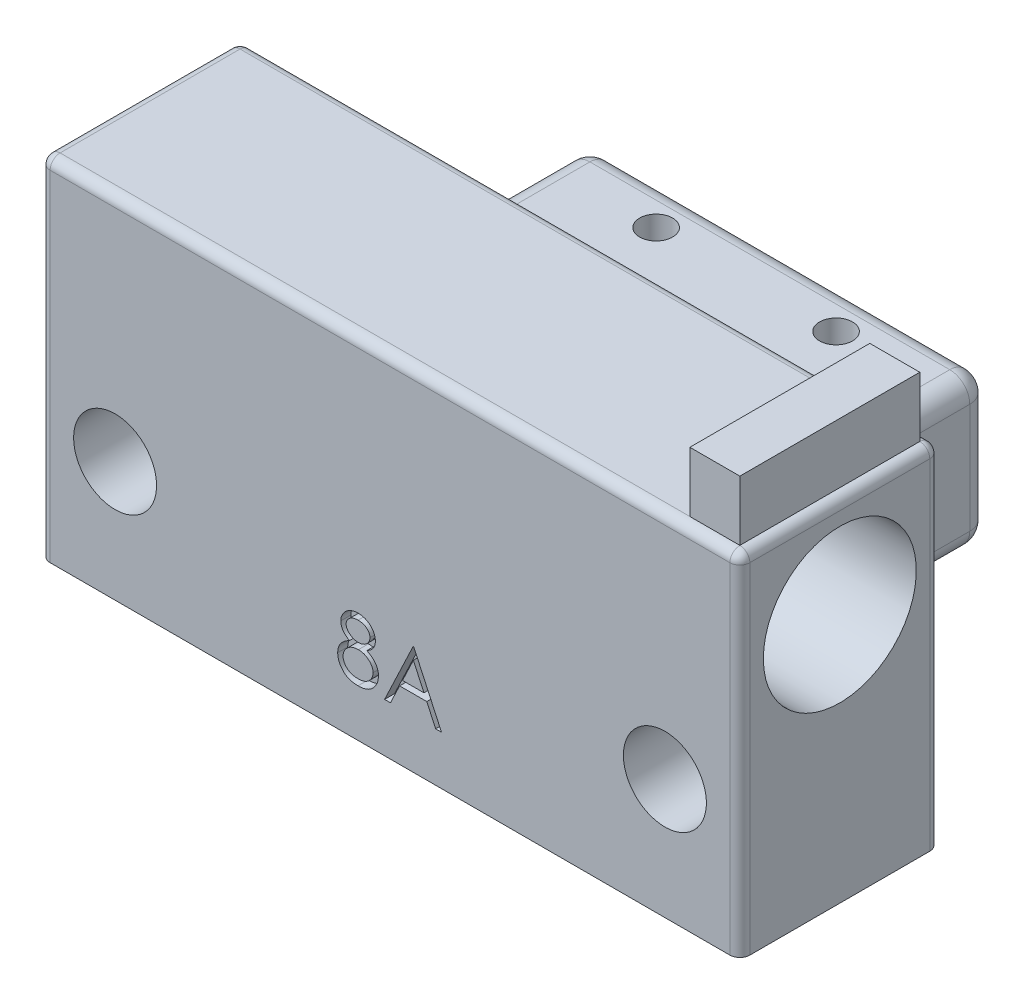
from build123d import *

# Parameters (mm, degrees)
CROQUIS1_W              = 70
CROQUIS1_H              = 20
SALIENTE_EXTRUIR1_DEPTH = 35
CROQUIS2_R              = 7.65
CORTAR_EXTRUIR1_DEPTH   = 79.89866919
CROQUIS3_R              = 4.15
CORTAR_EXTRUIR2_DEPTH   = 54.38539126
REDONDEO1_R             = 1
CROQUIS5_W              = 40
CROQUIS5_H              = 15
SALIENTE_EXTRUIR3_DEPTH = 20
REDONDEO3_R             = 2
CORTAR_EXTRUIR3_REACH   = 53.844
CROQUIS6_R              = 1.65
CORTAR_EXTRUIR4_DEPTH   = 1
CROQUIS8_W              = 5
CROQUIS8_H              = 18
SALIENTE_EXTRUIR4_DEPTH = 6


with BuildPart() as part:
    # Croquis1 → Saliente-Extruir1 (new body)
    with BuildSketch(Plane(origin=(0, 0, 0), x_dir=(1, 0, 0), z_dir=(0, 1, 0))):
        Rectangle(CROQUIS1_W, CROQUIS1_H)
    extrude(amount=SALIENTE_EXTRUIR1_DEPTH)

    # Croquis2 → Cortar-Extruir1 (cut, through all)
    with BuildSketch(Plane.ZY.offset(35)):
        with Locations((0, 25)):
            Circle(CROQUIS2_R)
    extrude(amount=-CORTAR_EXTRUIR1_DEPTH, mode=Mode.SUBTRACT)

    # Croquis3 → Cortar-Extruir2 (cut, through all)
    with BuildSketch(Plane(origin=(0, 0, -10), x_dir=(-1, 0, 0), z_dir=(0, 0, -1))):
        with Locations((-27.5, 12)):
            Circle(CROQUIS3_R)
        with Locations((27.5, 12)):
            Circle(CROQUIS3_R)
    extrude(amount=-CORTAR_EXTRUIR2_DEPTH, mode=Mode.SUBTRACT)

    # Redondeo1
    redondeo1_edges = [part.edges().sort_by_distance(p)[0] for p in [
        (-35, 35, 0),
        (0, 35, 10),
        (35, 35, 0),
        (0, 35, -10),
        (35, 17.5, 10),
        (-35, 17.5, 10),
        (-35, 17.5, -10),
        (35, 17.5, -10),
    ]]
    fillet(redondeo1_edges, radius=REDONDEO1_R)

    # Croquis5 → Saliente-Extruir3 (add)
    with BuildSketch(Plane(origin=(0, 0, -10), x_dir=(-1, 0, 0), z_dir=(0, 0, -1))):
        with Locations((0, 16.2232378)):
            Rectangle(CROQUIS5_W, CROQUIS5_H)
    extrude(amount=SALIENTE_EXTRUIR3_DEPTH)

    # Redondeo3
    redondeo3_edges = [part.edges().sort_by_distance(p)[0] for p in [
        (-20, 16.2232378, -10),
        (-20, 8.7232378, -20),
        (0, 23.7232378, -10),
        (-20, 23.7232378, -20),
        (20, 16.2232378, -10),
        (20, 23.7232378, -20),
        (0, 8.7232378, -10),
        (20, 8.7232378, -20),
        (-20, 16.2232378, -30),
        (0, 23.7232378, -30),
        (20, 16.2232378, -30),
        (0, 8.7232378, -30),
    ]]
    fillet(redondeo3_edges, radius=REDONDEO3_R)

    # Croquis6 → Cortar-Extruir3 (cut, up to next)
    with BuildSketch(Plane(origin=(0, 23.7232378, 0), x_dir=(1, 0, 0), z_dir=(0, 1, 0)), mode=Mode.PRIVATE) as cortar_extruir3_sk1:
        with Locations(Location((9, 14.375, 0), (0, 0, 270))):
            Circle(CROQUIS6_R)
    cortar_extruir3_tool1 = extrude(cortar_extruir3_sk1.sketch, amount=-CORTAR_EXTRUIR3_REACH, mode=Mode.PRIVATE) & part.part
    # Croquis6 → Cortar-Extruir3 (cut, up to next)
    with BuildSketch(Plane(origin=(0, 23.7232378, 0), x_dir=(1, 0, 0), z_dir=(0, 1, 0)), mode=Mode.PRIVATE) as cortar_extruir3_sk2:
        with Locations(Location((9, 25.625, 0), (0, 0, 270))):
            Circle(CROQUIS6_R)
    cortar_extruir3_tool2 = extrude(cortar_extruir3_sk2.sketch, amount=-CORTAR_EXTRUIR3_REACH, mode=Mode.PRIVATE) & part.part
    # Croquis6 → Cortar-Extruir3 (cut, up to next)
    with BuildSketch(Plane(origin=(0, 23.7232378, 0), x_dir=(1, 0, 0), z_dir=(0, 1, 0)), mode=Mode.PRIVATE) as cortar_extruir3_sk3:
        with Locations(Location((-9, 25.625, 0), (0, 0, 270))):
            Circle(CROQUIS6_R)
    cortar_extruir3_tool3 = extrude(cortar_extruir3_sk3.sketch, amount=-CORTAR_EXTRUIR3_REACH, mode=Mode.PRIVATE) & part.part
    # Croquis6 → Cortar-Extruir3 (cut, up to next)
    with BuildSketch(Plane(origin=(0, 23.7232378, 0), x_dir=(1, 0, 0), z_dir=(0, 1, 0)), mode=Mode.PRIVATE) as cortar_extruir3_sk4:
        with Locations(Location((-9, 14.375, 0), (0, 0, 270))):
            Circle(CROQUIS6_R)
    cortar_extruir3_tool4 = extrude(cortar_extruir3_sk4.sketch, amount=-CORTAR_EXTRUIR3_REACH, mode=Mode.PRIVATE) & part.part
    add(cortar_extruir3_tool1.solids().sort_by_distance((9, 23.723238, -14.375))[0], mode=Mode.SUBTRACT)
    add(cortar_extruir3_tool2.solids().sort_by_distance((9, 23.723238, -25.625))[0], mode=Mode.SUBTRACT)
    add(cortar_extruir3_tool3.solids().sort_by_distance((-9, 23.723238, -25.625))[0], mode=Mode.SUBTRACT)
    add(cortar_extruir3_tool4.solids().sort_by_distance((-9, 23.723238, -14.375))[0], mode=Mode.SUBTRACT)

    # Croquis7 → Cortar-Extruir4 (cut)
    # profile 1 of 2: a face of its own
    with BuildSketch(Plane.XY.offset(10)):
        with BuildLine():
            add(Edge.make_bspline(
                [(-2.313701923, 8.228996938), (-2.264590128, 8.203389014), (-2.168805726, 8.153445009), (-2.032387655, 8.073026447), (-1.907716224, 7.988270507), (-1.791332404, 7.903180462), (-1.685280945, 7.814497631), (-1.590747666, 7.721869364), (-1.50539746, 7.627607743), (-1.430951545, 7.530116589), (-1.365471253, 7.429654904), (-1.308879022, 7.325959008), (-1.260506674, 7.21925615), (-1.222170208, 7.108381584), (-1.190589993, 6.994963993), (-1.168860385, 6.877538881), (-1.15717424, 6.756880011), (-1.154964845, 6.675334351), (-1.153846154, 6.634045015)],
                knots=[0, 0, 0, 0, 1.272397273, 2.481599622, 3.635517121, 4.734568067, 5.792894095, 6.808321871, 7.773003508, 8.711915296, 9.623354172, 10.525449501, 11.423591555, 12.311487226, 13.218079475, 14.126165749, 15.051214107, 16, 16, 16, 16], degree=3))
            add(Edge.make_bspline(
                [(-1.153846154, 6.634045015), (-1.155168589, 6.576277473), (-1.157786185, 6.461933833), (-1.180586157, 6.293169071), (-1.214722692, 6.129263159), (-1.264573284, 5.970252032), (-1.329224811, 5.817013106), (-1.408899387, 5.669415209), (-1.499090025, 5.52503925), (-1.571522435, 5.43620599), (-1.608173077, 5.391256554)],
                knots=[0, 0, 0, 0, 1.025265484, 2.029385089, 3.018602448, 3.995076438, 4.983346944, 5.966715145, 6.97116228, 8, 8, 8, 8], degree=3))
            add(Edge.make_bspline(
                [(-1.608173077, 5.391256554), (-1.655892747, 5.338810084), (-1.750742402, 5.234565239), (-1.913227421, 5.099220993), (-2.091550651, 4.985479175), (-2.285022078, 4.892784498), (-2.493124538, 4.820637312), (-2.715813688, 4.768792995), (-2.953523665, 4.739097402), (-3.116904472, 4.734804849), (-3.200721154, 4.732602707)],
                knots=[0, 0, 0, 0, 0.954267603, 1.896743057, 2.838368354, 3.796610408, 4.779680527, 5.799409237, 6.871065594, 8, 8, 8, 8], degree=3))
            add(Edge.make_bspline(
                [(-3.200721154, 4.732602707), (-3.281315534, 4.734578384), (-3.438144013, 4.73842285), (-3.66641466, 4.764470447), (-3.879197065, 4.810118218), (-4.077728439, 4.872594691), (-4.260811914, 4.953869368), (-4.427925802, 5.05502664), (-4.581481183, 5.171994827), (-4.716817994, 5.308133247), (-4.836969612, 5.453946742), (-4.942514846, 5.604378073), (-5.030241838, 5.759440972), (-5.104516859, 5.916823316), (-5.161376326, 6.078731008), (-5.200757258, 6.244331031), (-5.225767511, 6.413334133), (-5.22909517, 6.527388396), (-5.230769231, 6.584766169)],
                knots=[0, 0, 0, 0, 1.256902934, 2.445805442, 3.576955095, 4.645999104, 5.686449165, 6.692658513, 7.68621702, 8.689161843, 9.678783111, 10.630372946, 11.551080876, 12.453998257, 13.34127905, 14.221779781, 15.105423033, 16, 16, 16, 16], degree=3))
            add(Edge.make_bspline(
                [(-5.230769231, 6.584766169), (-5.229778578, 6.626867641), (-5.227820697, 6.71007501), (-5.214269529, 6.833005287), (-5.192483595, 6.952655804), (-5.162895955, 7.069468507), (-5.122797052, 7.182592974), (-5.074381967, 7.292565215), (-5.017927191, 7.399509385), (-4.952645194, 7.504010324), (-4.876698867, 7.604603773), (-4.790704039, 7.702996907), (-4.692941978, 7.797662965), (-4.584500278, 7.88975855), (-4.46661821, 7.980917362), (-4.336233872, 8.066212897), (-4.196803699, 8.151683694), (-4.097708717, 8.20278368), (-4.046875, 8.228996938)],
                knots=[0, 0, 0, 0, 0.941657376, 1.861047343, 2.762797495, 3.66048619, 4.553285746, 5.444104102, 6.34607688, 7.256116206, 8.197091036, 9.162375105, 10.176350973, 11.237807142, 12.343728897, 13.50695164, 14.721116704, 16, 16, 16, 16], degree=3))
            add(Edge.make_bspline(
                [(-4.046875, 8.228996938), (-4.116460214, 8.266942256), (-4.251196664, 8.340415012), (-4.429601421, 8.475409536), (-4.582842489, 8.621617219), (-4.70670772, 8.782125439), (-4.804202968, 8.95192008), (-4.871092004, 9.129938799), (-4.916343119, 9.312880707), (-4.92082568, 9.437862759), (-4.923076923, 9.500631554)],
                knots=[0, 0, 0, 0, 1.166880483, 2.259407225, 3.286803203, 4.280235371, 5.237608625, 6.161067461, 7.076446754, 8, 8, 8, 8], degree=3))
            add(Edge.make_bspline(
                [(-4.923076923, 9.500631554), (-4.920273339, 9.564570225), (-4.914637646, 9.693098105), (-4.869066239, 9.884422888), (-4.794803268, 10.072337), (-4.693795844, 10.25592965), (-4.567989188, 10.428987161), (-4.417052253, 10.584200212), (-4.244589458, 10.720162753), (-4.051461686, 10.834293335), (-3.843628139, 10.927179607), (-3.624344041, 10.991256904), (-3.397430053, 11.033147389), (-3.242976819, 11.037890226), (-3.164663462, 11.040295015)],
                knots=[0, 0, 0, 0, 0.888701115, 1.786444228, 2.72001202, 3.692817113, 4.693886446, 5.687152267, 6.695133018, 7.739871481, 8.800368666, 9.853104506, 10.91144658, 12, 12, 12, 12], degree=3))
            add(Edge.make_bspline(
                [(-3.164663462, 11.040295015), (-3.088371207, 11.03781557), (-2.937931573, 11.032926386), (-2.716797926, 10.992148881), (-2.505212422, 10.924041133), (-2.303904709, 10.831645893), (-2.116478651, 10.717839708), (-1.950874692, 10.580009639), (-1.804590266, 10.425481266), (-1.683588447, 10.252476232), (-1.583880637, 10.069589043), (-1.514450521, 9.87823615), (-1.469961422, 9.682552049), (-1.464349941, 9.550144042), (-1.461538462, 9.48380463)],
                knots=[0, 0, 0, 0, 1.072916533, 2.115669174, 3.151510826, 4.193348718, 5.225979165, 6.227137561, 7.216255879, 8.211077061, 9.189680878, 10.138522389, 11.067357538, 12, 12, 12, 12], degree=3))
            add(Edge.make_bspline(
                [(-1.461538462, 9.48380463), (-1.463997708, 9.418701778), (-1.468827529, 9.290843476), (-1.509455997, 9.104455156), (-1.57787882, 8.929903089), (-1.671297385, 8.765206599), (-1.793055364, 8.613352604), (-1.941527478, 8.472410084), (-2.115530012, 8.341221235), (-2.24626296, 8.267187468), (-2.313701923, 8.228996938)],
                knots=[0, 0, 0, 0, 0.975232327, 1.915300861, 2.843280834, 3.77672583, 4.742871857, 5.749627742, 6.839139064, 8, 8, 8, 8], degree=3))
        make_face()
        with BuildLine():
            add(Edge.make_bspline(
                [(-3.194711538, 10.4249104), (-3.236798634, 10.423793644), (-3.319139396, 10.421608783), (-3.439874261, 10.410193977), (-3.554684034, 10.387988462), (-3.664768263, 10.358436385), (-3.768617656, 10.31851412), (-3.867642606, 10.271551247), (-3.960157789, 10.214455135), (-4.047280022, 10.150407367), (-4.125709922, 10.079962385), (-4.195317724, 10.006567438), (-4.253137349, 9.928781052), (-4.302236394, 9.84853815), (-4.337861852, 9.763457162), (-4.364543516, 9.676146574), (-4.382580187, 9.585503058), (-4.383931713, 9.523554754), (-4.384615385, 9.492218092)],
                knots=[0, 0, 0, 0, 1.203892937, 2.355340988, 3.463153438, 4.544400666, 5.610487187, 6.640501085, 7.674077295, 8.714426146, 9.728707835, 10.68524104, 11.601827946, 12.495867327, 13.368432065, 14.231010473, 15.105153427, 16, 16, 16, 16], degree=3))
            add(Edge.make_bspline(
                [(-4.384615385, 9.492218092), (-4.383437041, 9.460880076), (-4.381108466, 9.398951653), (-4.363099675, 9.307501597), (-4.336259352, 9.217635935), (-4.294001076, 9.131491516), (-4.24331589, 9.046080043), (-4.180759074, 8.963536181), (-4.106206455, 8.883572664), (-4.022159414, 8.806869622), (-3.930596778, 8.735043171), (-3.833595561, 8.672689146), (-3.732373176, 8.620516385), (-3.627969628, 8.577094548), (-3.519320861, 8.54334037), (-3.407092621, 8.519394119), (-3.291266046, 8.504510695), (-3.21278505, 8.502732945), (-3.173076923, 8.501833477)],
                knots=[0, 0, 0, 0, 0.873023192, 1.725219244, 2.590779336, 3.480155217, 4.391973325, 5.357036234, 6.360879153, 7.436073238, 8.526419356, 9.601555421, 10.645666583, 11.697338044, 12.750135903, 13.812665442, 14.89329948, 16, 16, 16, 16], degree=3))
            add(Edge.make_bspline(
                [(-3.173076923, 8.501833477), (-3.122076745, 8.50332982), (-3.020580115, 8.506307728), (-2.870958404, 8.533995455), (-2.725479585, 8.577548457), (-2.585698606, 8.63713697), (-2.455233602, 8.711927587), (-2.338936343, 8.801469904), (-2.237798812, 8.903696356), (-2.152872052, 9.017015503), (-2.087026601, 9.137618226), (-2.035766359, 9.258647299), (-2.005832847, 9.381393981), (-2.001928446, 9.463623062), (-2, 9.504237323)],
                knots=[0, 0, 0, 0, 1.076279235, 2.141928126, 3.20205304, 4.278698113, 5.344010996, 6.36967002, 7.368914609, 8.37248503, 9.349703398, 10.264243087, 11.142681841, 12, 12, 12, 12], degree=3))
            add(Edge.make_bspline(
                [(-2, 9.504237323), (-2.000911824, 9.532742527), (-2.002721665, 9.589321272), (-2.017636047, 9.672872756), (-2.042280332, 9.75452347), (-2.075645612, 9.834947934), (-2.119548117, 9.913017761), (-2.17160101, 9.989960197), (-2.234831584, 10.064044364), (-2.305796898, 10.136996733), (-2.386274742, 10.204512202), (-2.47611002, 10.263885991), (-2.574842164, 10.314307174), (-2.682473506, 10.355259325), (-2.798607662, 10.386017638), (-2.922709732, 10.409051377), (-3.055814499, 10.422033854), (-3.147408358, 10.423930755), (-3.194711538, 10.4249104)],
                knots=[0, 0, 0, 0, 0.814439003, 1.616544685, 2.417341072, 3.248991801, 4.09997495, 4.973547432, 5.9003056, 6.880240646, 7.880314356, 8.896779544, 9.951930927, 11.043077905, 12.18215768, 13.381699519, 14.647792085, 16, 16, 16, 16], degree=3))
        make_face(mode=Mode.SUBTRACT)
        with BuildLine():
            add(Edge.make_bspline(
                [(-3.159855769, 7.886448861), (-3.213214259, 7.885499762), (-3.317890596, 7.88363786), (-3.47124533, 7.862913002), (-3.618422185, 7.834062614), (-3.758924933, 7.790295462), (-3.892694242, 7.733387193), (-4.020454269, 7.664927982), (-4.141227634, 7.584004365), (-4.253346593, 7.491644453), (-4.355729444, 7.39211396), (-4.445555101, 7.2867503), (-4.521836565, 7.177511672), (-4.583264995, 7.063010708), (-4.633685107, 6.945671947), (-4.666794611, 6.822573212), (-4.688020402, 6.696081018), (-4.690870627, 6.610092278), (-4.692307692, 6.566737323)],
                knots=[0, 0, 0, 0, 1.140299081, 2.23698856, 3.303958914, 4.344563908, 5.37730929, 6.408454204, 7.439741482, 8.480804886, 9.510774543, 10.48932336, 11.43758569, 12.353841022, 13.263987381, 14.161954604, 15.073269652, 16, 16, 16, 16], degree=3))
            add(Edge.make_bspline(
                [(-4.692307692, 6.566737323), (-4.689970677, 6.512855769), (-4.685334094, 6.405956027), (-4.648551285, 6.24796219), (-4.589518938, 6.09501181), (-4.507189996, 5.94835132), (-4.405245586, 5.811293995), (-4.279885927, 5.691827522), (-4.138901634, 5.585676416), (-3.977522455, 5.499824073), (-3.801245085, 5.431261465), (-3.610116407, 5.384022671), (-3.406879403, 5.352751614), (-3.266548674, 5.349600447), (-3.194711538, 5.347987323)],
                knots=[0, 0, 0, 0, 0.898778495, 1.783155532, 2.693654817, 3.627872908, 4.583023416, 5.533784346, 6.509005473, 7.520592997, 8.575161974, 9.658835044, 10.801527049, 12, 12, 12, 12], degree=3))
            add(Edge.make_bspline(
                [(-3.194711538, 5.347987323), (-3.138568051, 5.34906528), (-3.029182532, 5.351165487), (-2.86960662, 5.369704277), (-2.719015965, 5.399103633), (-2.577702596, 5.441863998), (-2.444084585, 5.494063957), (-2.320427407, 5.561216097), (-2.203549932, 5.637591508), (-2.099211436, 5.728205491), (-2.004183078, 5.825027482), (-1.921326005, 5.927524699), (-1.849398775, 6.032911497), (-1.792945708, 6.14356947), (-1.747814987, 6.25737561), (-1.715374607, 6.375379343), (-1.695358238, 6.4979426), (-1.693333846, 6.581083865), (-1.692307692, 6.623227707)],
                knots=[0, 0, 0, 0, 1.224942928, 2.386581632, 3.501229538, 4.569074225, 5.605009692, 6.626002462, 7.634866581, 8.645888296, 9.63523824, 10.59253846, 11.518950513, 12.414518923, 13.29783783, 14.186679152, 15.080837789, 16, 16, 16, 16], degree=3))
            add(Edge.make_bspline(
                [(-1.692307692, 6.623227707), (-1.693860576, 6.664160291), (-1.69692259, 6.744872196), (-1.716356918, 6.864471956), (-1.750498422, 6.980019638), (-1.797345388, 7.092905362), (-1.859712752, 7.200841849), (-1.933161101, 7.306641), (-2.02177959, 7.407366334), (-2.121915469, 7.503800213), (-2.231045116, 7.592970047), (-2.347045936, 7.671851942), (-2.469025014, 7.738284141), (-2.596724232, 7.792312419), (-2.729860042, 7.834805224), (-2.86833452, 7.864489787), (-3.012309791, 7.883174821), (-3.110118141, 7.885345185), (-3.159855769, 7.886448861)],
                knots=[0, 0, 0, 0, 0.917430815, 1.809013306, 2.70690318, 3.612392954, 4.541220862, 5.495268465, 6.494511384, 7.542276156, 8.608045339, 9.649016899, 10.681629292, 11.715607085, 12.752076957, 13.808767841, 14.885711793, 16, 16, 16, 16], degree=3))
        make_face(mode=Mode.SUBTRACT)
    # profile 2 of 2: a face of its own
    with BuildSketch(Plane.XY.offset(10)):
        Polygon((2.384615385, 10.886448861), (5.153846154, 4.886448861), (4.568509615, 4.886448861), (3.681490385, 6.809525784), (0.961538462, 6.809525784), (0.049278846, 4.886448861), (-0.538461538, 4.886448861), (2.307692308, 10.886448861), align=None)
        Polygon((2.340144231, 9.716977707), (1.253605769, 7.4249104), (3.397836538, 7.4249104), align=None, mode=Mode.SUBTRACT)
    extrude(amount=-CORTAR_EXTRUIR4_DEPTH, mode=Mode.SUBTRACT)

    # Croquis8 → Saliente-Extruir4 (add)
    with BuildSketch(Plane(origin=(0, 35, 0), x_dir=(1, 0, 0), z_dir=(0, 1, 0))):
        with Locations((31.5, 0)):
            Rectangle(CROQUIS8_W, CROQUIS8_H)
    extrude(amount=SALIENTE_EXTRUIR4_DEPTH)


solid = part.part
